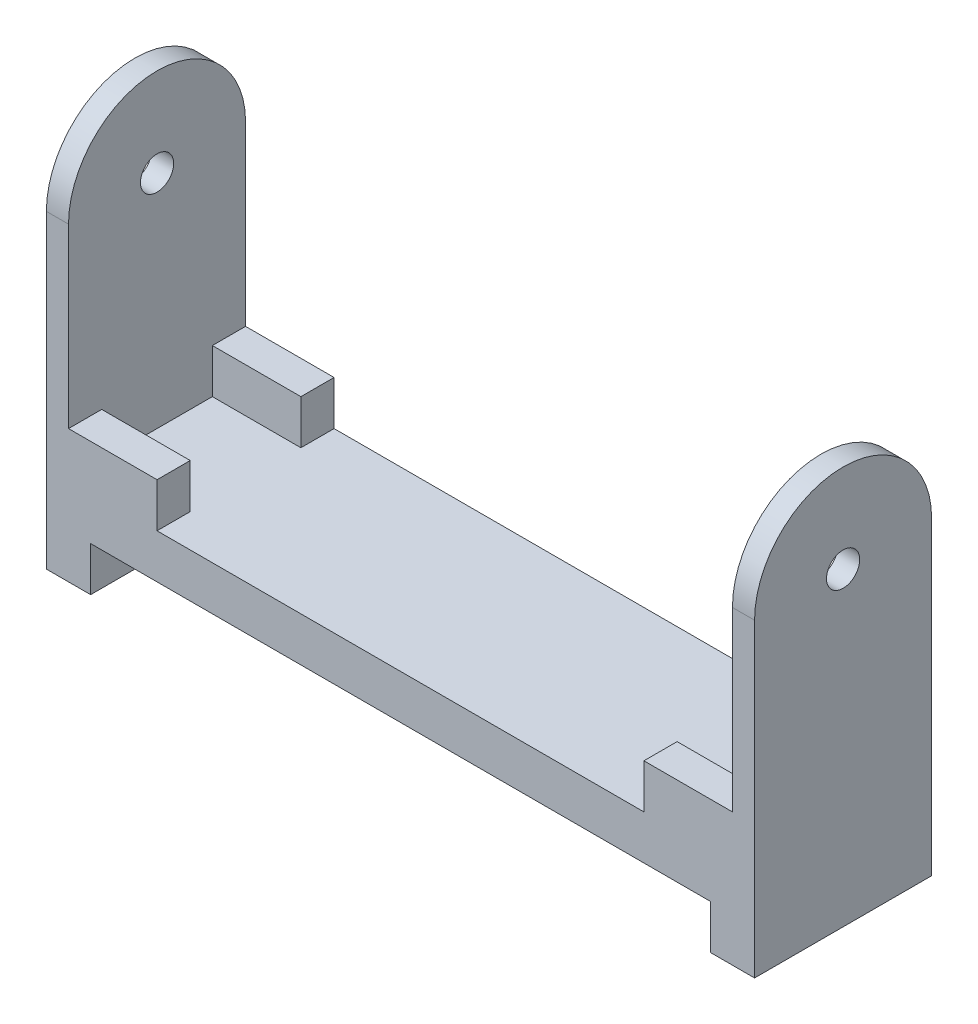
from build123d import *

# Parameters (mm, degrees)
SKETCH_2_R             = 7.5
EXTRUDE_1_DEPTH        = 320
SKETCH_3_W             = 300
SKETCH_3_H             = 140
CUT_EXTRUDE_1_DEPTH    = 351.998575496
SKETCH_4_W             = 20
SKETCH_4_H             = 80
EXTRUDE_2_DEPTH        = 20
SKETCH_5_W             = 10
SKETCH_5_H             = 10
CUT_EXTRUDE_1480_DEPTH = 30
SKETCH_7_W             = 40
SKETCH_7_H             = 15
EXTRUDE_1842_DEPTH     = 20


with BuildPart() as part:
    # 草圖2 → 填料-伸長1 (new body)
    with BuildSketch(Plane(origin=(0, 0, 0), x_dir=(0, 0, -1), z_dir=(1, 0, 0))):
        with BuildLine():
            Line((-40, 0), (-40, -120))
            Line((-40, -120), (40, -120))
            Line((40, -120), (40, 0))
            ThreePointArc((40, 0), (0, 40), (-40, 0))
        make_face()
        Circle(SKETCH_2_R, mode=Mode.SUBTRACT)
    extrude(amount=EXTRUDE_1_DEPTH)

    # 草圖3 → 除料-伸長1 (cut, through all)
    with BuildSketch(Plane(origin=(0, 0, -40), x_dir=(-1, 0, 0), z_dir=(0, 0, -1))):
        with Locations((-160, -30)):
            Rectangle(SKETCH_3_W, SKETCH_3_H)
    extrude(amount=-CUT_EXTRUDE_1_DEPTH, mode=Mode.SUBTRACT)

    # 草圖4 → 填料-伸長2 (add)
    with BuildSketch(Plane.XZ.offset(120)):
        with Locations((10, 0)):
            Rectangle(SKETCH_4_W, SKETCH_4_H)
        with Locations((310, 0)):
            Rectangle(SKETCH_4_W, SKETCH_4_H)
    extrude(amount=EXTRUDE_2_DEPTH)

    # 草圖5 → Cut-Extrude 1480 (cut)
    with BuildSketch(Plane.XZ.offset(140)):
        with Locations((10, 0)):
            Rectangle(SKETCH_5_W, SKETCH_5_H)
        with Locations((310, 0)):
            Rectangle(SKETCH_5_W, SKETCH_5_H)
    extrude(amount=-CUT_EXTRUDE_1480_DEPTH, mode=Mode.SUBTRACT)

    # 草圖7 → Extrude 1842 (add)
    with BuildSketch(Plane(origin=(0, -100, 0), x_dir=(1, 0, 0), z_dir=(0, 1, 0))):
        with Locations((30, 32.5)):
            Rectangle(SKETCH_7_W, SKETCH_7_H)
        with Locations((30, -32.5)):
            Rectangle(SKETCH_7_W, SKETCH_7_H)
        with Locations((290, -32.5)):
            Rectangle(SKETCH_7_W, SKETCH_7_H)
        with Locations((290, 32.5)):
            Rectangle(SKETCH_7_W, SKETCH_7_H)
    extrude(amount=EXTRUDE_1842_DEPTH)


solid = part.part
